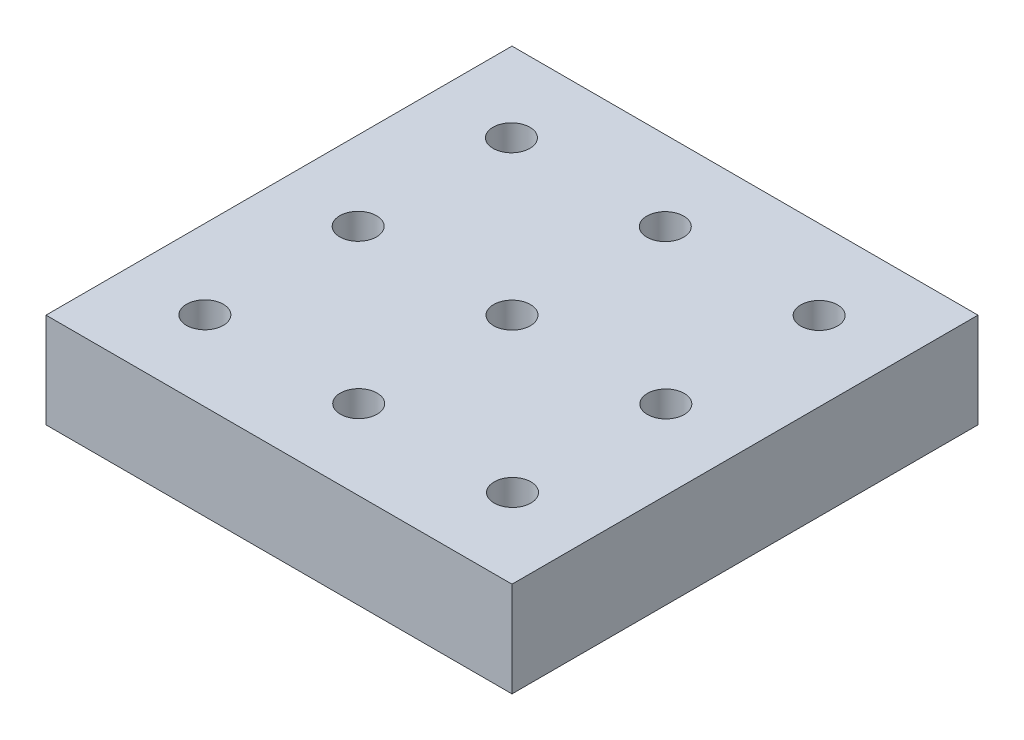
from build123d import *

# Parameters (mm, degrees)
SKETCH1_W           = 76
SKETCH1_H           = 76
SKETCH1_R           = 3
BOSS_EXTRUDE1_DEPTH = 15.5


with BuildPart() as part:
    # Sketch1 → Boss-Extrude1 (new body)
    with BuildSketch(Plane(origin=(0, 0, 0), x_dir=(1, 0, 0), z_dir=(0, 1, 0))):
        with Locations((-159.8596663, 81.710219679)):
            Rectangle(SKETCH1_W, SKETCH1_H)
        with Locations(Location((-159.8596663, 81.710219679, 0), (0, 0, 270))):
            Circle(SKETCH1_R, mode=Mode.SUBTRACT)
        with Locations(Location((-134.769453056, 81.710219679, 0), (0, 0, 270))):
            Circle(SKETCH1_R, mode=Mode.SUBTRACT)
        with Locations(Location((-184.949879544, 81.710219679, 0), (0, 0, 90))):
            Circle(SKETCH1_R, mode=Mode.SUBTRACT)
        with Locations(Location((-184.949879544, 106.710219679, 0), (0, 0, 90))):
            Circle(SKETCH1_R, mode=Mode.SUBTRACT)
        with Locations(Location((-159.8596663, 106.710219679, 0), (0, 0, 270))):
            Circle(SKETCH1_R, mode=Mode.SUBTRACT)
        with Locations(Location((-134.769453056, 106.710219679, 0), (0, 0, 270))):
            Circle(SKETCH1_R, mode=Mode.SUBTRACT)
        with Locations(Location((-134.769453056, 56.710219679, 0), (0, 0, 90))):
            Circle(SKETCH1_R, mode=Mode.SUBTRACT)
        with Locations(Location((-159.8596663, 56.710219679, 0), (0, 0, 90))):
            Circle(SKETCH1_R, mode=Mode.SUBTRACT)
        with Locations(Location((-184.949879544, 56.710219679, 0), (0, 0, 270))):
            Circle(SKETCH1_R, mode=Mode.SUBTRACT)
    extrude(amount=BOSS_EXTRUDE1_DEPTH)


solid = part.part
